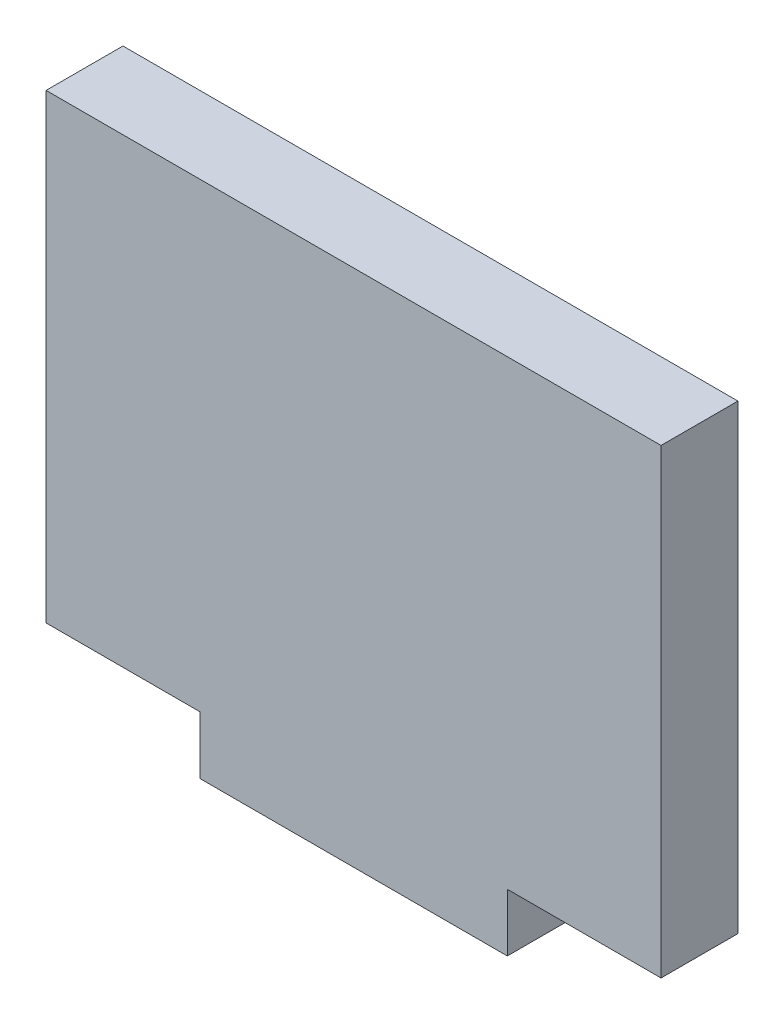
from build123d import *

# Parameters (mm, degrees)
BOSS_EXTRUDE1_DEPTH = 3.175


with BuildPart() as part:
    # Sketch1 → Boss-Extrude1 (new body)
    with BuildSketch(Plane.XY):
        Polygon((6.35, 0), (6.35, -2.387934918), (19.05, -2.387934918), (19.05, 0), (25.4, 0), (25.4, 19.05), (0, 19.05), (0, 0), align=None)
    extrude(amount=BOSS_EXTRUDE1_DEPTH)


solid = part.part
